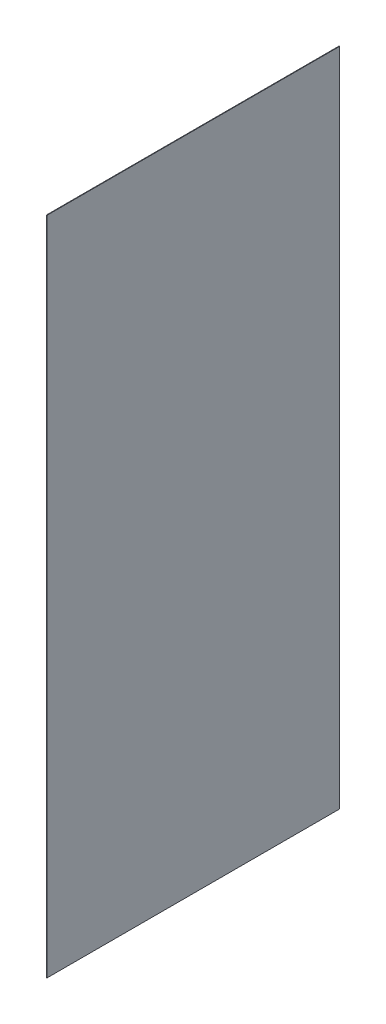
from build123d import *

# Parameters (mm, degrees)
SKETCH1_W                 = 1.5
SKETCH1_H                 = 1850
PRESS_DIS_YAN_SOL_1_DEPTH = 820


with BuildPart() as part:
    # Sketch1 → PRESS_dis_yan_sol_1 (new body)
    with BuildSketch(Plane.XY):
        with Locations((0.75, 1045)):
            Rectangle(SKETCH1_W, SKETCH1_H)
    extrude(amount=-PRESS_DIS_YAN_SOL_1_DEPTH)


solid = part.part
